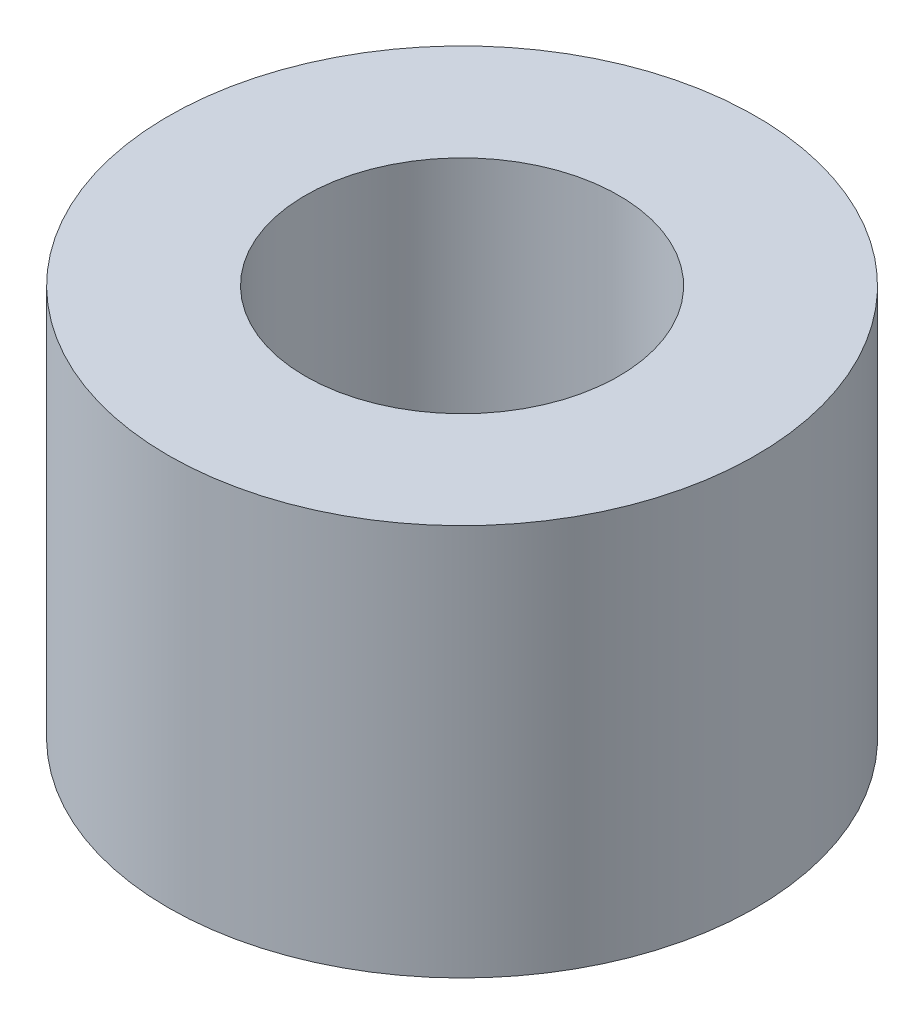
from build123d import *

# Parameters (mm, degrees)
SKETCH1_R           = 3
SKETCH1_R_2         = 1.6
BOSS_EXTRUDE1_DEPTH = 4


with BuildPart() as part:
    # Sketch1 → Boss-Extrude1 (new body)
    with BuildSketch(Plane(origin=(0, 0, 0), x_dir=(1, 0, 0), z_dir=(0, 1, 0))):
        with Locations(Location((0, 0, 0), (0, 0, 270))):
            Circle(SKETCH1_R)
        with Locations(Location((0, 0, 0), (0, 0, 270))):
            Circle(SKETCH1_R_2, mode=Mode.SUBTRACT)
    extrude(amount=BOSS_EXTRUDE1_DEPTH)


solid = part.part
